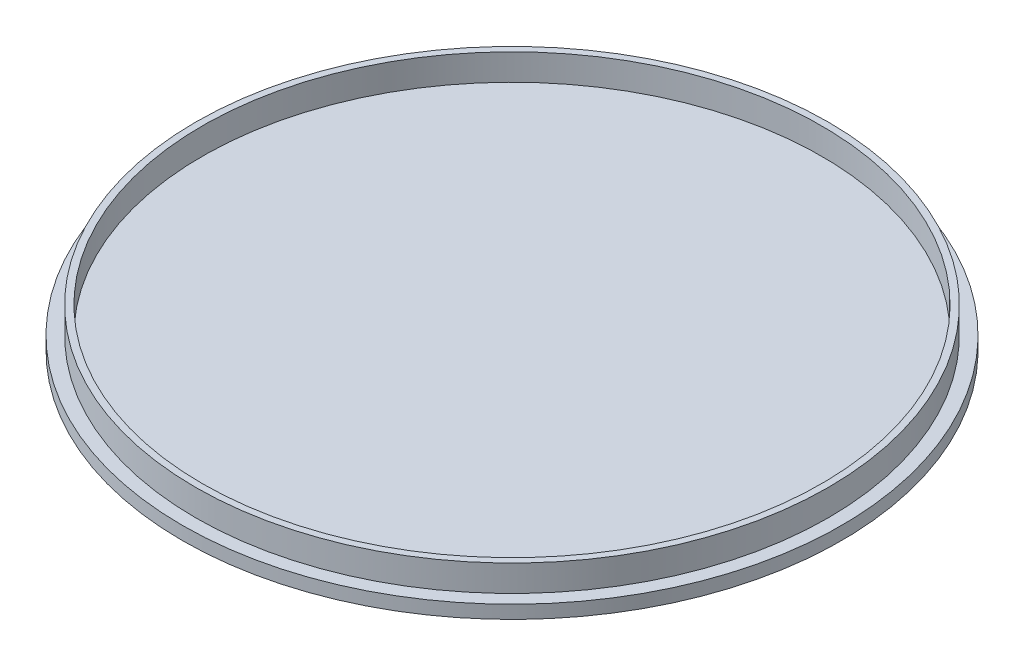
from build123d import *

# Parameters (mm, degrees)
SKETCH1_R           = 50
BOSS_EXTRUDE1_DEPTH = 2
SKETCH2_R           = 48
SKETCH2_R_2         = 47
BOSS_EXTRUDE2_DEPTH = 4


with BuildPart() as part:
    # Sketch1 → Boss-Extrude1 (new body)
    with BuildSketch(Plane(origin=(0, 0, 0), x_dir=(1, 0, 0), z_dir=(0, 1, 0))):
        with Locations(Location((0, 0, 0), (0, 0, 270))):
            Circle(SKETCH1_R)
    extrude(amount=BOSS_EXTRUDE1_DEPTH)

    # Sketch2 → Boss-Extrude2 (add)
    with BuildSketch(Plane(origin=(0, 2, 0), x_dir=(1, 0, 0), z_dir=(0, 1, 0))):
        with Locations(Location((0, 0, 0), (0, 0, 270))):
            Circle(SKETCH2_R)
        with Locations(Location((0, 0, 0), (0, 0, 270))):
            Circle(SKETCH2_R_2, mode=Mode.SUBTRACT)
    extrude(amount=BOSS_EXTRUDE2_DEPTH)


solid = part.part
